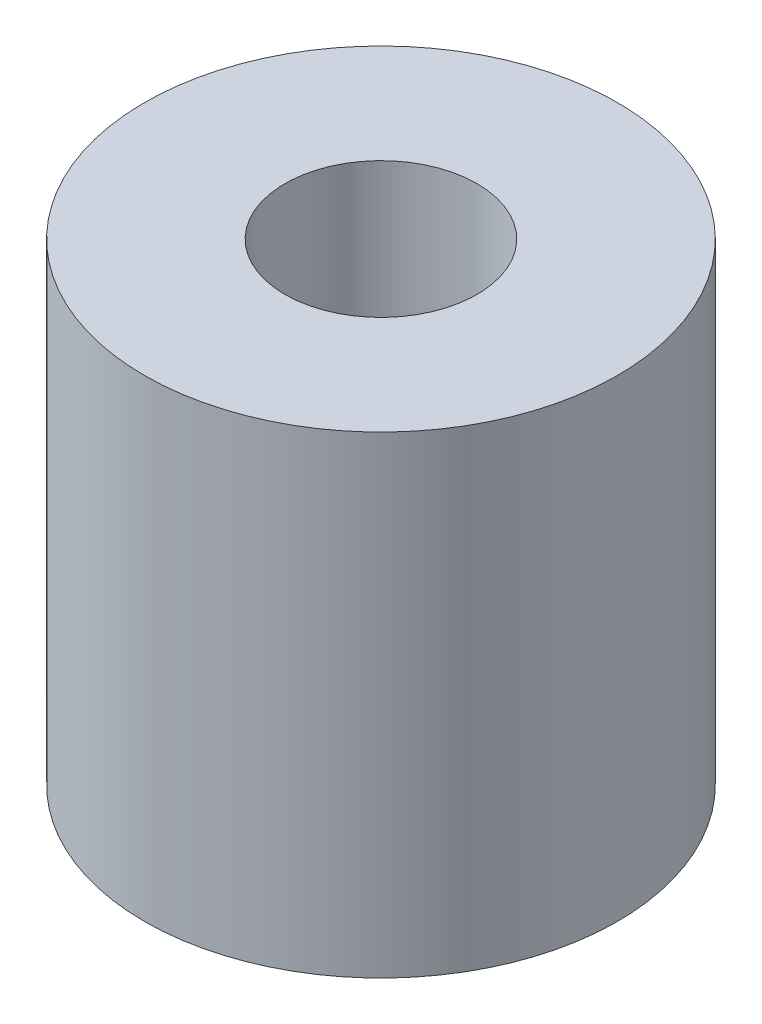
from build123d import *

# Parameters (mm, degrees)
SKETCH1_R           = 6.35
SKETCH1_R_2         = 2.5796875
BOSS_EXTRUDE1_DEPTH = 12.7


with BuildPart() as part:
    # Sketch1 → Boss-Extrude1 (new body)
    with BuildSketch(Plane(origin=(0, 0, 0), x_dir=(1, 0, 0), z_dir=(0, 1, 0))):
        with Locations(Location((0, 0, 0), (0, 0, 270))):
            Circle(SKETCH1_R)
        with Locations(Location((0, 0, 0), (0, 0, 270))):
            Circle(SKETCH1_R_2, mode=Mode.SUBTRACT)
    extrude(amount=BOSS_EXTRUDE1_DEPTH)


solid = part.part
